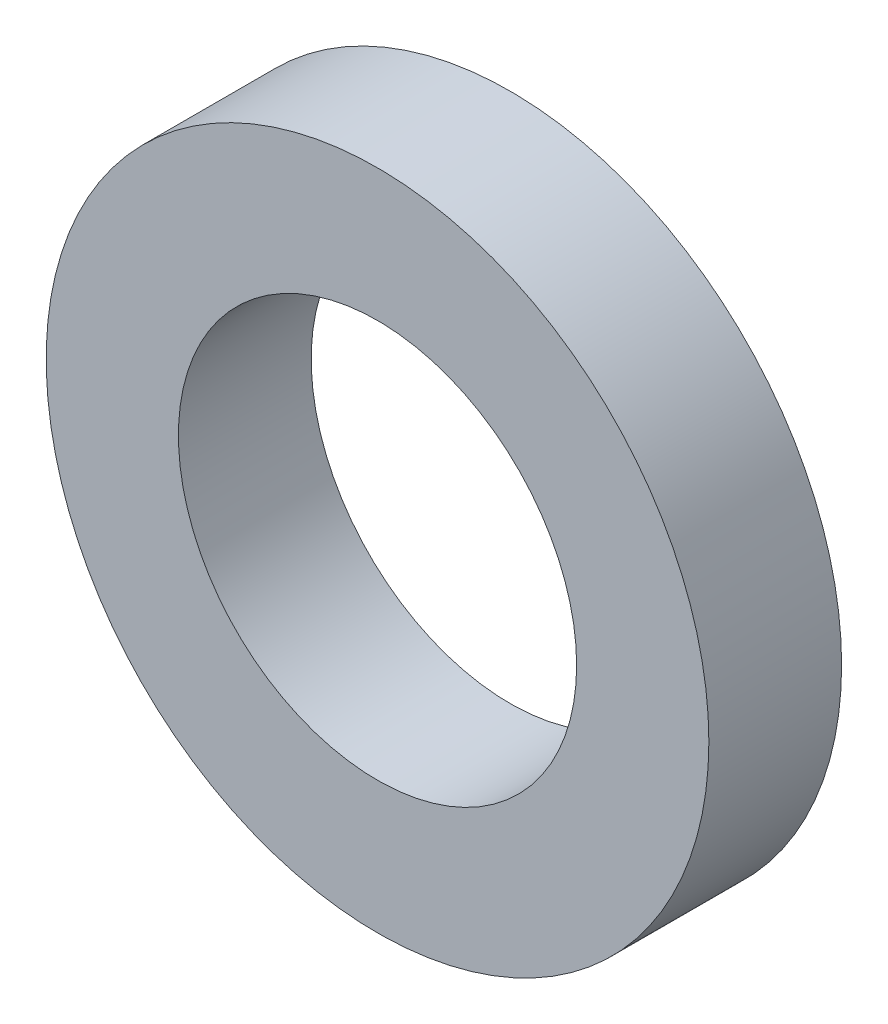
from build123d import *

# Parameters (mm, degrees)
SKETCH1_R           = 3.9624
SKETCH1_R_2         = 2.38125
BOSS_EXTRUDE1_DEPTH = 1.5875


with BuildPart() as part:
    # Sketch1 → Boss-Extrude1 (new body)
    with BuildSketch(Plane.XY):
        Circle(SKETCH1_R)
        Circle(SKETCH1_R_2, mode=Mode.SUBTRACT)
    extrude(amount=BOSS_EXTRUDE1_DEPTH)


solid = part.part
